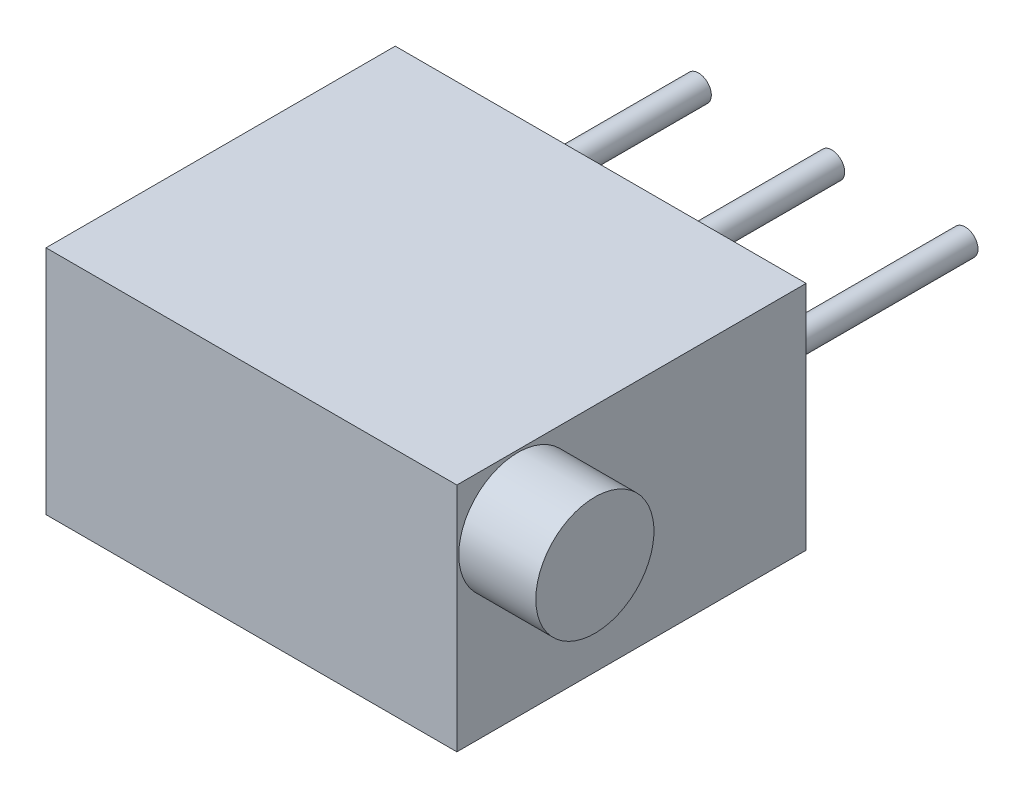
from build123d import *

# Parameters (mm, degrees)
SKETCH_1_W      = 8
SKETCH_1_H      = 6.8
EXTRUDE_1_DEPTH = 4.5
SKETCH_3_R      = 0.25
EXTRUDE_3_DEPTH = 4.5
SKETCH_4_R      = 1.15
EXTRUDE_4_DEPTH = 1.5


with BuildPart() as part:
    # 草图1 → 拉伸1 (new body)
    with BuildSketch(Plane(origin=(0, 0, 0), x_dir=(1, 0, 0), z_dir=(0, 1, 0))):
        Rectangle(SKETCH_1_W, SKETCH_1_H)
    extrude(amount=EXTRUDE_1_DEPTH)

    # 草图3 → 拉伸3 (add)
    with BuildSketch(Plane(origin=(0, 0, -3.4), x_dir=(-1, 0, 0), z_dir=(0, 0, -1))):
        with Locations(Location((0, 2.25, 0), (0, 0, 180))):
            Circle(SKETCH_3_R)
        with Locations(Location((2.595978382, 2.25, 0), (0, 0, 180))):
            Circle(SKETCH_3_R)
        with Locations(Location((-2.595978382, 2.25, 0), (0, 0, 180))):
            Circle(SKETCH_3_R)
    extrude(amount=EXTRUDE_3_DEPTH)

    # 草图4 → 拉伸4 (add)
    with BuildSketch(Plane(origin=(4, 0, -0.6), x_dir=(0, 0, 1), z_dir=(-1, 0, 0))):
        with Locations((2.813059067, 3.304845193)):
            Circle(SKETCH_4_R)
    extrude(amount=-EXTRUDE_4_DEPTH)


solid = part.part
